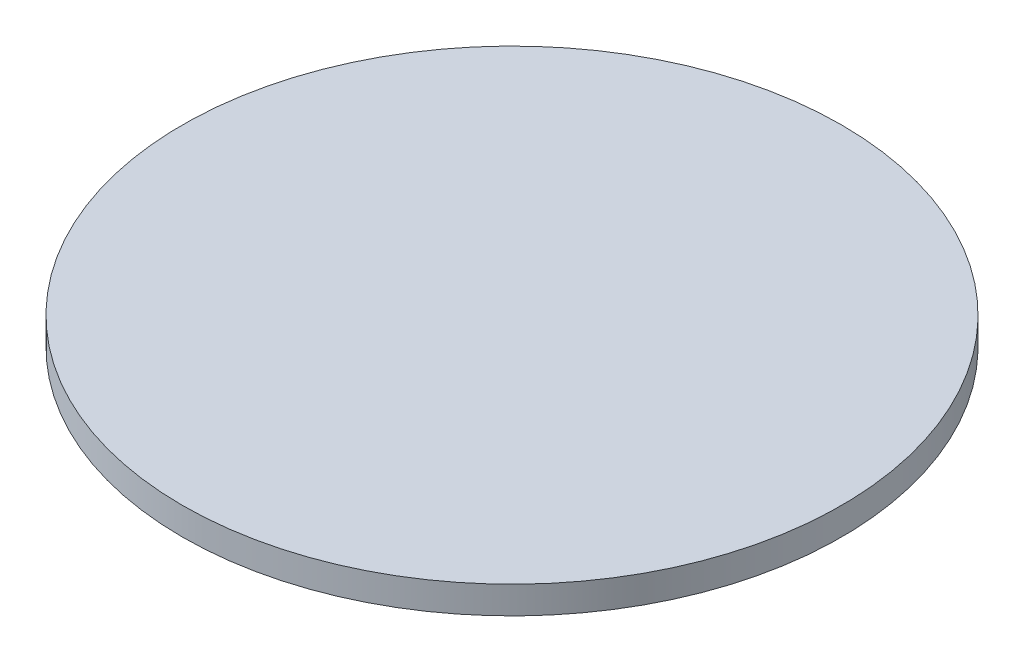
from build123d import *

# Parameters (mm, degrees)
SKETCH2_R           = 152.4
BOSS_EXTRUDE1_DEPTH = 12.7


with BuildPart() as part:
    # Sketch2 → Boss-Extrude1 (new body)
    with BuildSketch(Plane(origin=(0, 0, 0), x_dir=(1, 0, 0), z_dir=(0, 1, 0))):
        with Locations(Location((0, 0, 0), (0, 0, 270))):
            Circle(SKETCH2_R)
    extrude(amount=BOSS_EXTRUDE1_DEPTH)


solid = part.part
